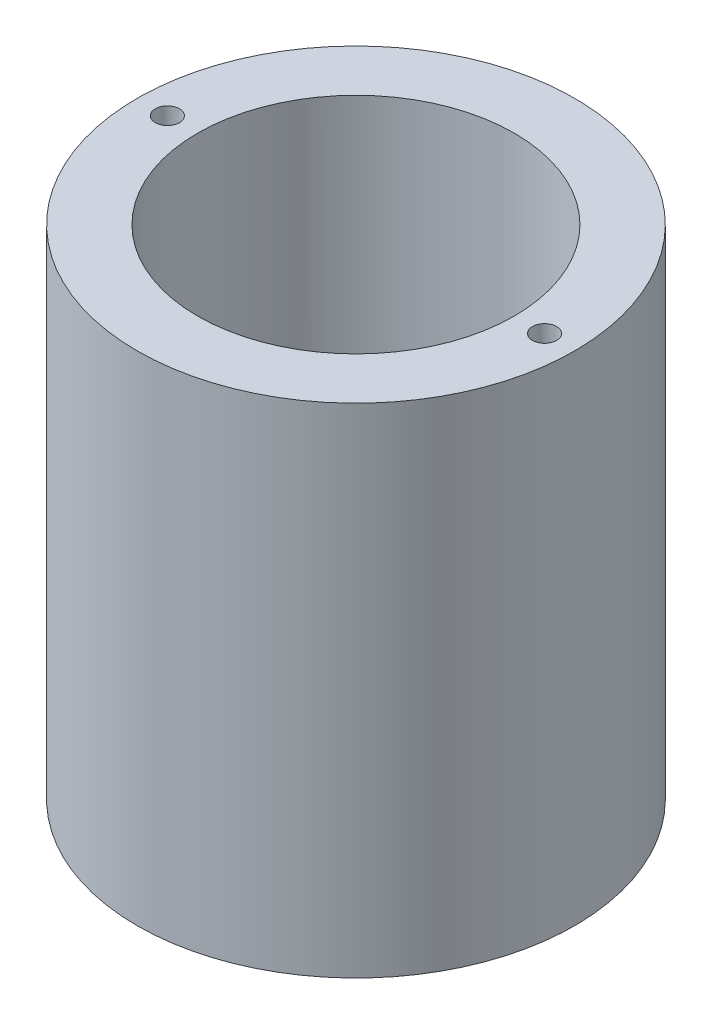
from build123d import *

# Parameters (mm, degrees)
SKETCH_1_R          = 13
SKETCH_1_R_2        = 9.172
EXTRUDE_1_DEPTH     = 25
SKETCH_7_R          = 10.172
CUT_EXTRUDE_2_DEPTH = 50
SKETCH_8_R          = 13
SKETCH_8_R_2        = 10.172
EXTRUDE_2_DEPTH     = 8
SKETCH_11_R         = 10.5
CUT_EXTRUDE_4_DEPTH = 50
EXTRUDE_START       = -33
SKETCH_13_R         = 14.5
SKETCH_13_R_2       = 13
EXTRUDE_3_DEPTH     = 33
SKETCH_4_R          = 0.8
CUT_EXTRUDE_1_DEPTH = 30
SKETCH_10_R         = 0.8
CUT_EXTRUDE_5_DEPTH = 7


with BuildPart() as part:
    # Эскиз1 → Бобышка-Вытянуть1 (new body)
    with BuildSketch(Plane(origin=(0, 0, 0), x_dir=(1, 0, 0), z_dir=(0, 1, 0))):
        with Locations(Location((0, 0, 0), (0, 0, 270))):
            Circle(SKETCH_1_R)
        with Locations(Location((0, 0, 0), (0, 0, 270))):
            Circle(SKETCH_1_R_2, mode=Mode.SUBTRACT)
    extrude(amount=EXTRUDE_1_DEPTH)

    # Эскиз7 → Вырез-Вытянуть2 (cut)
    with BuildSketch(Plane.XZ):
        with Locations(Location((0, 0, 0), (0, 0, 270))):
            Circle(SKETCH_7_R)
    extrude(amount=-CUT_EXTRUDE_2_DEPTH, mode=Mode.SUBTRACT)

    # Эскиз8 → Бобышка-Вытянуть2 (add)
    with BuildSketch(Plane(origin=(0, 25, 0), x_dir=(1, 0, 0), z_dir=(0, 1, 0))):
        with Locations(Location((0, 0, 0), (0, 0, 270))):
            Circle(SKETCH_8_R)
        with Locations(Location((0, 0, 0), (0, 0, 90))):
            Circle(SKETCH_8_R_2, mode=Mode.SUBTRACT)
    extrude(amount=EXTRUDE_2_DEPTH)

    # Эскиз11 → Вырез-Вытянуть4 (cut)
    with BuildSketch(Plane.XZ):
        with Locations(Location((0, 0, 0), (0, 0, 270))):
            Circle(SKETCH_11_R)
    extrude(amount=-CUT_EXTRUDE_4_DEPTH, mode=Mode.SUBTRACT)

    # Эскиз13 → Бобышка-Вытянуть3 (add)
    with BuildSketch(Plane(origin=(0, 33, 0), x_dir=(1, 0, 0), z_dir=(0, 1, 0)).offset(EXTRUDE_START)):
        with Locations(Location((0, 0, 0), (0, 0, 270))):
            Circle(SKETCH_13_R)
        Circle(SKETCH_13_R_2, mode=Mode.SUBTRACT)
    extrude(amount=EXTRUDE_3_DEPTH)

    # Эскиз4 → Вырез-Вытянуть1 (cut)
    with BuildSketch(Plane(origin=(0, 0, 0), x_dir=(0, 0, -1), z_dir=(1, 0, 0))):
        with Locations((0, 10)):
            Circle(SKETCH_4_R)
    extrude(amount=-CUT_EXTRUDE_1_DEPTH, mode=Mode.SUBTRACT)

    # Эскиз10 → Вырез-Вытянуть5 (cut)
    with BuildSketch(Plane(origin=(0, 33, 0), x_dir=(1, 0, 0), z_dir=(0, 1, 0))):
        with Locations(Location((-12.5, 0, 0), (0, 0, 180))):
            Circle(SKETCH_10_R)
        with Locations((12.5, 0)):
            Circle(SKETCH_10_R)
    extrude(amount=-CUT_EXTRUDE_5_DEPTH, mode=Mode.SUBTRACT)


solid = part.part
